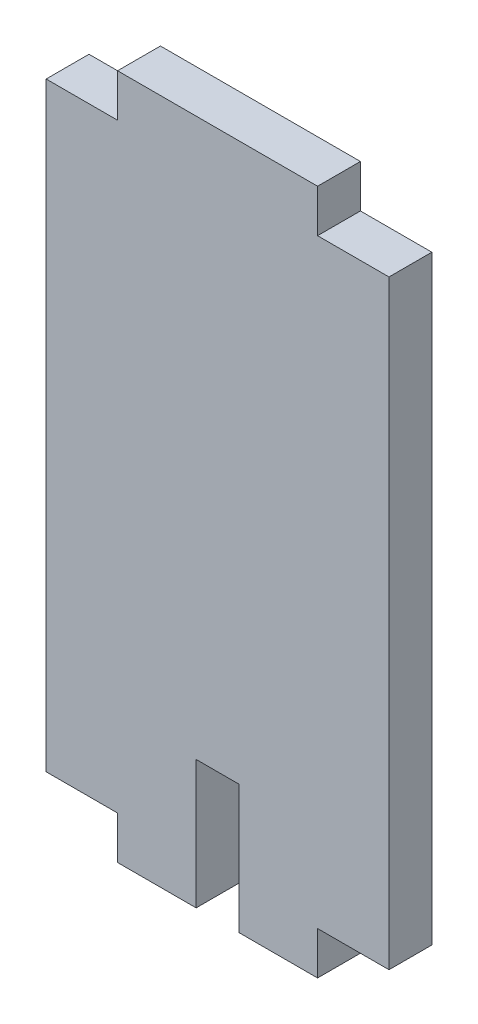
from build123d import *

# Parameters (mm, degrees)
SKETCH1_W           = 50.8
SKETCH1_H           = 101.6
BOSS_EXTRUDE1_DEPTH = 6.35
SKETCH2_W           = 6.35
SKETCH2_H           = 19.05
SKETCH2_W_2         = 10.583333333
SKETCH2_H_2         = 6.35
CUT_EXTRUDE1_DEPTH  = 6.35


with BuildPart() as part:
    # Sketch1 → Boss-Extrude1 (new body)
    with BuildSketch(Plane.XY):
        with Locations((25.4, 50.8)):
            Rectangle(SKETCH1_W, SKETCH1_H)
    extrude(amount=BOSS_EXTRUDE1_DEPTH)

    # Sketch2 → Cut-Extrude1 (cut)
    with BuildSketch(Plane.XY.offset(6.35)):
        with Locations((25.4, 9.525)):
            Rectangle(SKETCH2_W, SKETCH2_H)
        with Locations((5.291666667, 98.425)):
            Rectangle(SKETCH2_W_2, SKETCH2_H_2)
        with Locations((45.508333334, 98.425)):
            Rectangle(SKETCH2_W_2, SKETCH2_H_2)
        with Locations((45.508333334, 3.175)):
            Rectangle(SKETCH2_W_2, SKETCH2_H_2)
        with Locations((5.291666667, 3.175)):
            Rectangle(SKETCH2_W_2, SKETCH2_H_2)
    extrude(amount=-CUT_EXTRUDE1_DEPTH, mode=Mode.SUBTRACT)


solid = part.part
